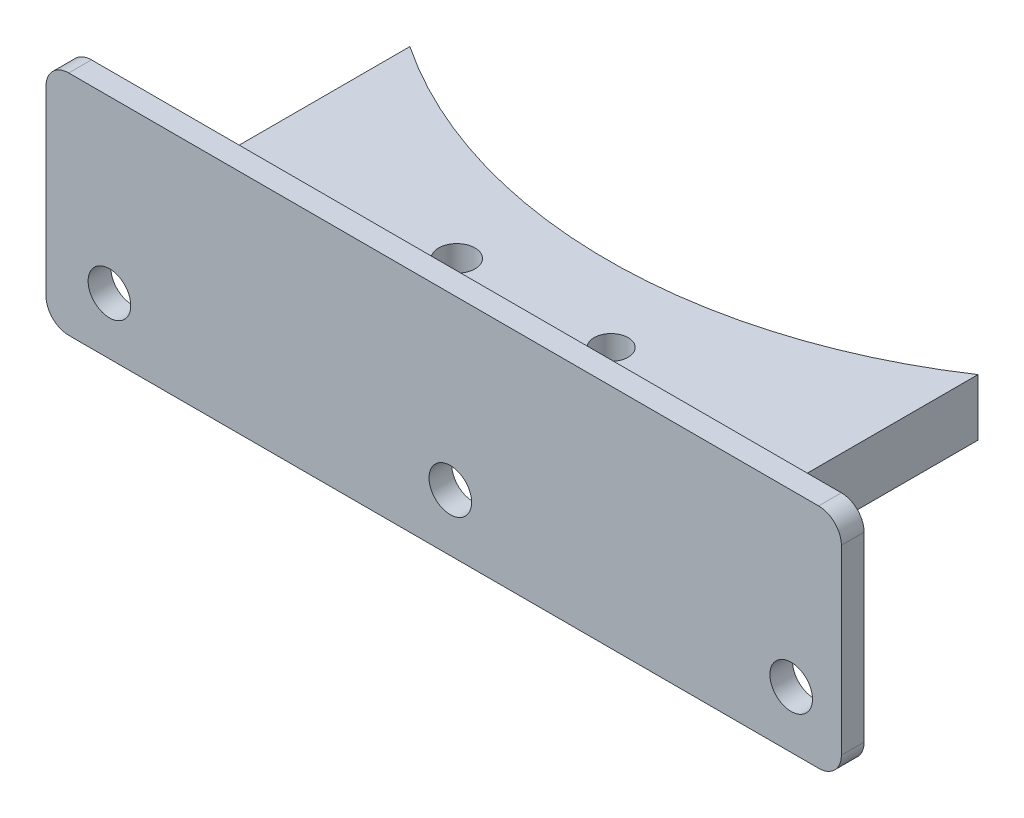
from build123d import *

# Parameters (mm, degrees)
SKETCH1_W           = 88.9
SKETCH1_H           = 25.4
BOSS_EXTRUDE1_DEPTH = 2.54
SKETCH2_R           = 2.032
SKETCH2_R_2         = 1.905
BOSS_EXTRUDE2_DEPTH = 6.35
SKETCH3_R           = 2.38125
CUT_EXTRUDE1_DEPTH  = 53.761321688
FILLET1_R           = 2.54


with BuildPart() as part:
    # Sketch1 → Boss-Extrude1 (new body)
    with BuildSketch(Plane.XY):
        Rectangle(SKETCH1_W, SKETCH1_H)
    extrude(amount=BOSS_EXTRUDE1_DEPTH)

    # Sketch2 → Boss-Extrude2 (add)
    with BuildSketch(Plane(origin=(0, 0, 0), x_dir=(1, 0, 0), z_dir=(0, 1, 0))):
        with BuildLine():
            Line((-31.75, 0), (-31.75, 25.429600199))
            ThreePointArc((-31.75, 25.429600199), (0, 15.8115), (31.75, 25.429600199))
            Line((31.75, 25.429600199), (31.75, 0))
            Line((31.75, 0), (0, 0))
            Line((0, 0), (-31.75, 0))
        make_face()
        with Locations(Location((-8.619949734, 7.549981355, 0), (0, 0, 270))):
            Circle(SKETCH2_R, mode=Mode.SUBTRACT)
        with Locations(Location((8.619949734, 7.549981355, 0), (0, 0, 270))):
            Circle(SKETCH2_R_2, mode=Mode.SUBTRACT)
    extrude(amount=BOSS_EXTRUDE2_DEPTH)

    # Sketch3 → Cut-Extrude1 (cut, through all)
    with BuildSketch(Plane(origin=(0, 0, 0), x_dir=(-1, 0, 0), z_dir=(0, 0, -1))):
        with Locations((-38.838399738, -6.35)):
            Circle(SKETCH3_R)
        with Locations((-0.738399738, -6.35)):
            Circle(SKETCH3_R)
        with Locations((37.361600262, -6.35)):
            Circle(SKETCH3_R)
    extrude(amount=-CUT_EXTRUDE1_DEPTH, mode=Mode.SUBTRACT)

    # Fillet1
    fillet1_edges = [part.edges().sort_by_distance(p)[0] for p in [
        (0, 6.35, 0),
        (31.75, 3.175, 0),
        (-31.75, 3.175, 0),
        (44.45, -12.7, 1.27),
        (-44.45, -12.7, 1.27),
        (-44.45, 12.7, 1.27),
        (44.45, 12.7, 1.27),
    ]]
    fillet(fillet1_edges, radius=FILLET1_R)


solid = part.part
